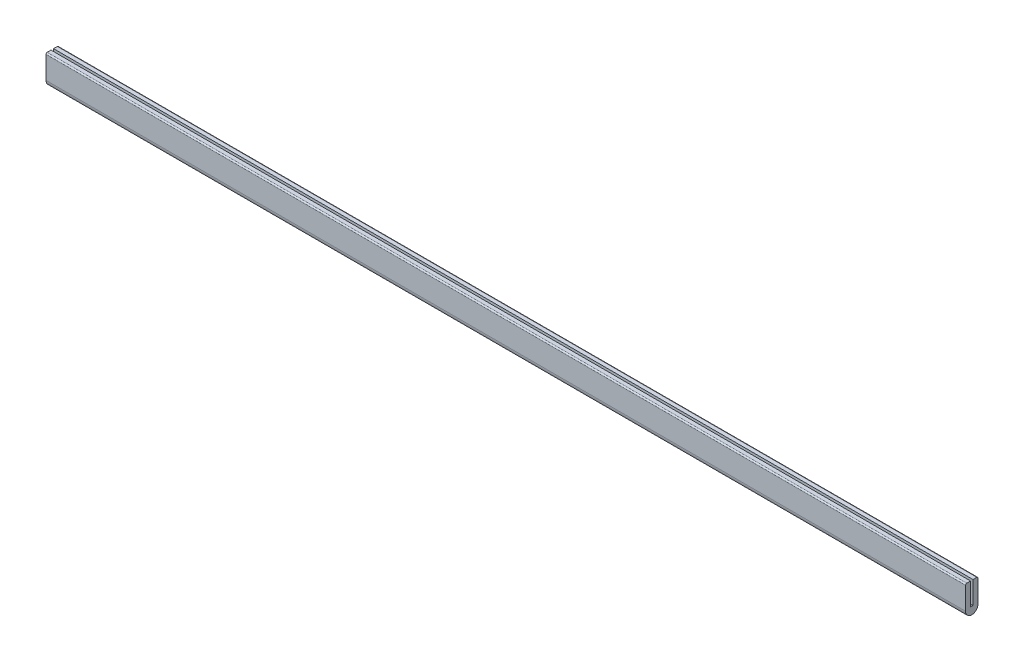
from build123d import *

# Parameters (mm, degrees)
BOSS_EXTRUDE1_DEPTH = 584.2
FILLET1_R           = 1.5875


with BuildPart() as part:
    # Sketch1 → Boss-Extrude1 (new, symmetric)
    with BuildSketch(Plane(origin=(0, 0, 0), x_dir=(0, 0, -1), z_dir=(1, 0, 0))):
        with BuildLine():
            Line((-1.5875, 28.575), (-7.9375, 28.575))
            Line((-7.9375, 28.575), (-7.9375, -1.5875))
            ThreePointArc((-7.9375, -1.5875), (0, -9.525), (7.9375, -1.5875))
            Line((7.9375, -1.5875), (7.9375, 28.575))
            Line((7.9375, 28.575), (1.5875, 28.575))
            Line((1.5875, 28.575), (1.5875, 0))
            Line((1.5875, 0), (-1.5875, 0))
            Line((-1.5875, 0), (-1.5875, 28.575))
        make_face()
    extrude(amount=BOSS_EXTRUDE1_DEPTH, both=True)

    # Fillet1
    fillet1_edges = [part.edges().sort_by_distance(p)[0] for p in [
        (0, 28.575, -7.9375),
        (0, 28.575, 7.9375),
    ]]
    fillet(fillet1_edges, radius=FILLET1_R)


solid = part.part
